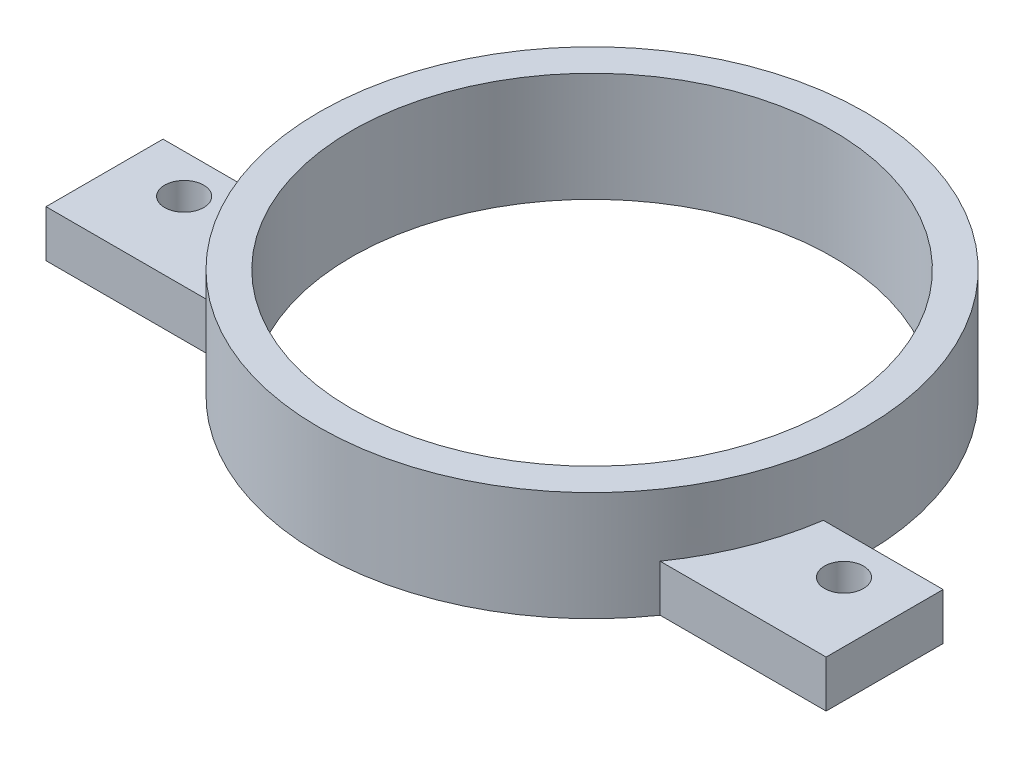
from build123d import *

# Parameters (mm, degrees)
SKETCH_1_R      = 30.85
EXTRUDE_1_DEPTH = 14
SKETCH_1_3_R    = 2.5
EXTRUDE_2_DEPTH = 6
SKETCH_1_4_R    = 2.5
EXTRUDE_3_DEPTH = 6


with BuildPart() as part:
    # 草图1 → 凸台-拉伸1 (new body)
    with BuildSketch(Plane(origin=(0, 0, 0), x_dir=(1, 0, 0), z_dir=(0, 1, 0))):
        with BuildLine():
            ThreePointArc((34.641016151, -5), (34.91013868, -2.506435188), (35, 0))
            ThreePointArc((35, 0), (0, 35), (-35, 0))
            ThreePointArc((-35, 0), (-34.91013868, -2.506435188), (-34.641016151, -5))
            ThreePointArc((-34.641016151, -5), (-32.557544726, -12.845477081), (-28.722813233, -20))
            ThreePointArc((-28.722813233, -20), (-26.7260394, -22.599088876), (-24.494897428, -25))
            ThreePointArc((-24.494897428, -25), (0, -35), (24.494897428, -25))
            ThreePointArc((24.494897428, -25), (26.7260394, -22.599088876), (28.722813233, -20))
            ThreePointArc((28.722813233, -20), (32.557544726, -12.845477081), (34.641016151, -5))
        make_face()
        Circle(SKETCH_1_R, mode=Mode.SUBTRACT)
    extrude(amount=EXTRUDE_1_DEPTH)

    # 草图1<3> → 凸台-拉伸2 (add)
    with BuildSketch(Plane(origin=(0, 0, 0), x_dir=(1, 0, 0), z_dir=(0, 1, 0))):
        with BuildLine():
            Line((50, -5), (34.641016151, -5))
            ThreePointArc((34.641016151, -5), (32.557544726, -12.845477081), (28.722813233, -20))
            Line((28.722813233, -20), (50, -20))
            Line((50, -20), (50, -5))
        make_face()
        with Locations((42.290199458, -10)):
            Circle(SKETCH_1_3_R, mode=Mode.SUBTRACT)
    extrude(amount=EXTRUDE_2_DEPTH)

    # 草图1<4> → 凸台-拉伸3 (add)
    with BuildSketch(Plane(origin=(0, 0, 0), x_dir=(1, 0, 0), z_dir=(0, 1, 0))):
        with BuildLine():
            ThreePointArc((-28.722813233, -20), (-32.557544726, -12.845477081), (-34.641016151, -5))
            Line((-34.641016151, -5), (-50, -5))
            Line((-50, -5), (-50, -20))
            Line((-50, -20), (-28.722813233, -20))
        make_face()
        with Locations((-42.290199458, -10)):
            Circle(SKETCH_1_4_R, mode=Mode.SUBTRACT)
    extrude(amount=EXTRUDE_3_DEPTH)


solid = part.part
